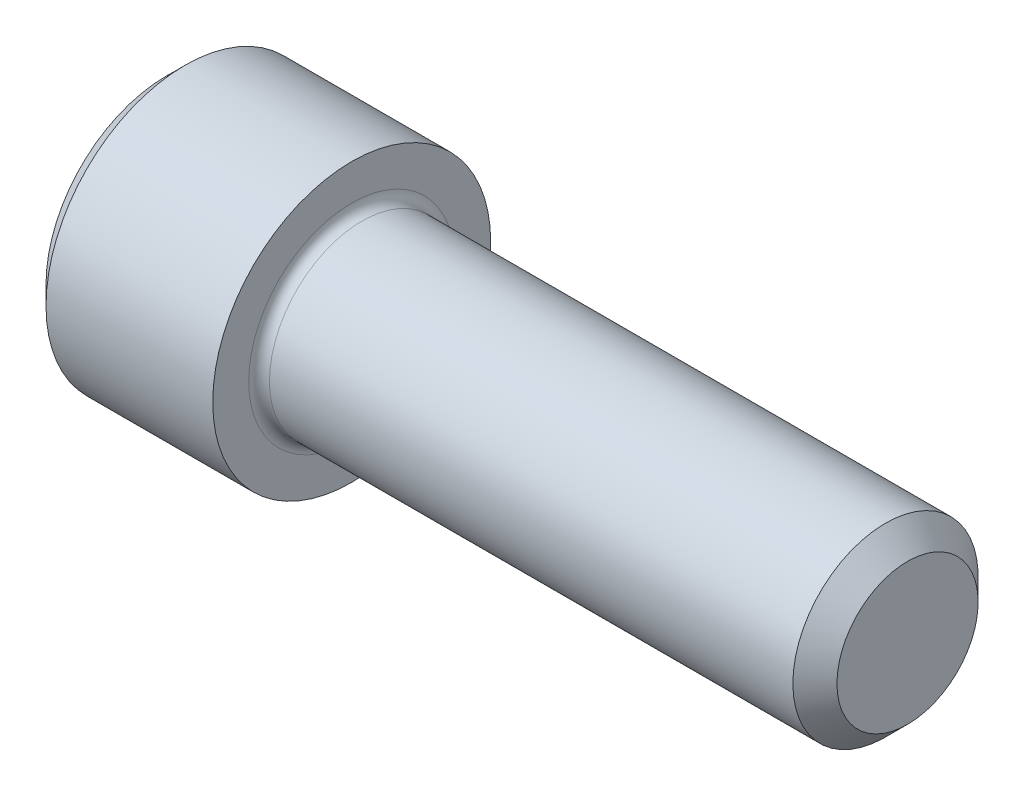
from build123d import *

# Parameters (mm, degrees)
FILLET1_R   = 0.3556
HEX_2_DEPTH = 3.048


with BuildPart() as part:
    # BodySke → Base-Revolve (revolve)
    with BuildSketch(Plane.XY, mode=Mode.PRIVATE) as base_revolve_sk:
        Polygon((0, 0), (0, 4.1275), (0.635, 4.7625), (6.35, 4.7625), (6.35, 3.175), (24.64435, 3.175), (25.4, 2.41935), (25.4, 0), align=None)
    revolve(base_revolve_sk.sketch.rotate(Axis((-31.75, 0, 0), (1, 0, 0)), 90), axis=Axis((-31.75, 0, 0), (1, 0, 0)))

    # Fillet1
    fillet1_edges = [part.edges().sort_by_distance(p)[0] for p in [
        (6.35, 0, -3.175),
    ]]
    fillet(fillet1_edges, radius=FILLET1_R)

    # Sketch2 → Hex-PreBroach (revolve, cut)
    with BuildSketch(Plane.XY, mode=Mode.PRIVATE) as hex_prebroach_sk:
        Polygon((0, 2.38125), (3.048, 2.38125), (4.422815329, 0), (0, 0), align=None)
    revolve(hex_prebroach_sk.sketch.rotate(Axis((0, 0, 0), (1, 0, 0)), 90), axis=Axis((0, 0, 0), (1, 0, 0)), mode=Mode.SUBTRACT)

    # Sketch3 → Hex 2 (cut)
    with BuildSketch(Plane(origin=(0, 0, 0), x_dir=(0, 0.500000000000001, 0.866025403784438), z_dir=(-1, 0, 0))):
        Polygon((1.374815329, 2.38125), (-1.374815329, 2.38125), (-2.749630657, 0), (-1.374815329, -2.38125), (1.374815329, -2.38125), (2.749630657, 0), align=None)
    extrude(amount=-HEX_2_DEPTH, mode=Mode.SUBTRACT)


solid = part.part
